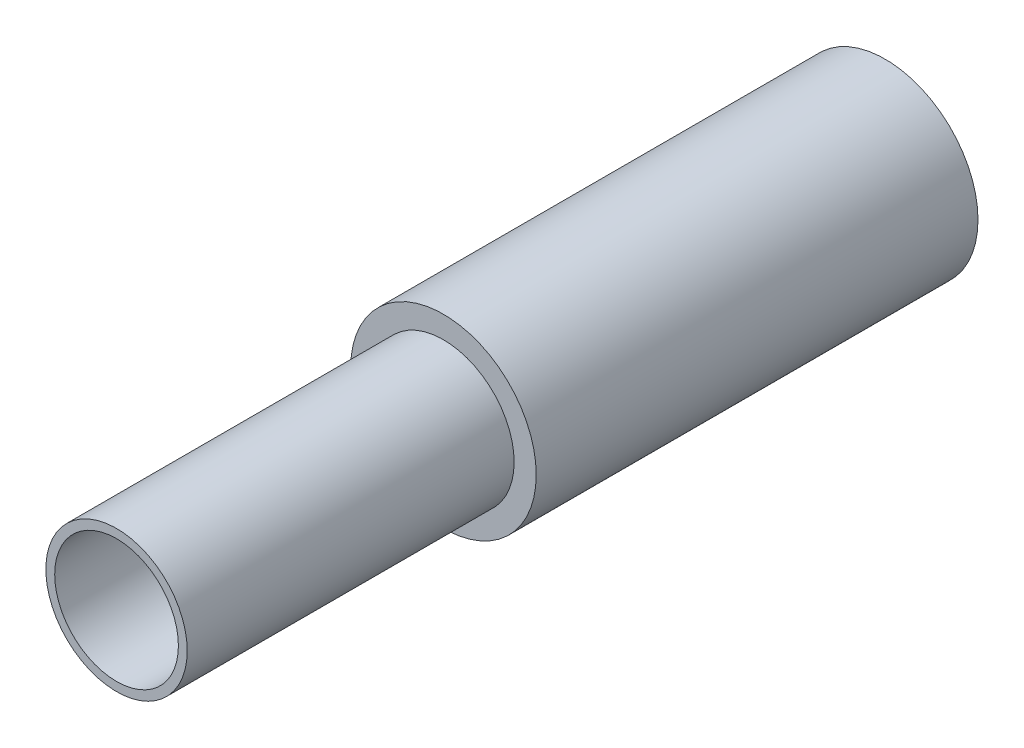
from build123d import *

# Parameters (mm, degrees)
SKETCH1_R           = 8
BOSS_EXTRUDE2_DEPTH = 37
SKETCH4_R           = 10.5
BOSS_EXTRUDE4_DEPTH = 50
SHELL1_T            = -1
CUT_EXTRUDE2_REACH  = 90.258
SKETCH5_R           = 9.5


with BuildPart() as part:
    # Sketch1 → Boss-Extrude2 (new body)
    with BuildSketch(Plane.XY):
        Circle(SKETCH1_R)
    extrude(amount=BOSS_EXTRUDE2_DEPTH)

    # Sketch4 → Boss-Extrude4 (add)
    with BuildSketch(Plane(origin=(0, 0, 0), x_dir=(-1, 0, 0), z_dir=(0, 0, -1))):
        Circle(SKETCH4_R)
    extrude(amount=BOSS_EXTRUDE4_DEPTH)

    # Shell1
    shell1_openings = [part.faces().sort_by_distance(p)[0] for p in [
        (0, 0, 37),
    ]]
    offset(amount=SHELL1_T, openings=shell1_openings, kind=Kind.INTERSECTION)

    # Sketch5 → Cut-Extrude2 (cut, up to next)
    with BuildSketch(Plane(origin=(0, 0, -50), x_dir=(-1, 0, 0), z_dir=(0, 0, -1)), mode=Mode.PRIVATE) as cut_extrude2_sk1:
        Circle(SKETCH5_R)
    cut_extrude2_tool1 = extrude(cut_extrude2_sk1.sketch, amount=-CUT_EXTRUDE2_REACH, mode=Mode.PRIVATE) & part.part
    add(cut_extrude2_tool1.solids().sort_by_distance((0, 0, -50))[0], mode=Mode.SUBTRACT)


solid = part.part
